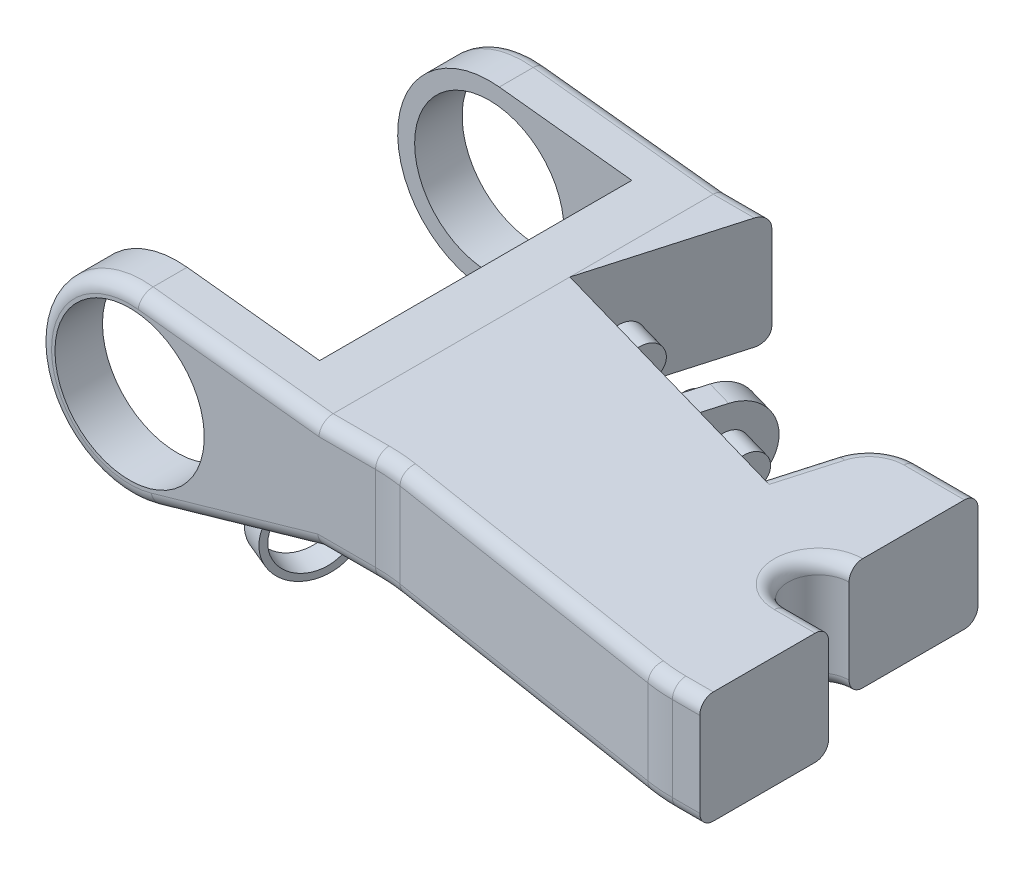
from build123d import *

# Parameters (mm, degrees)
EXTRUDE_1_DEPTH          = 13.5
CUT_EXTRUDE_1_DEPTH      = 134.515916654
CUT_EXTRUDE_1_DEPTH_BACK = 134.515916654
SKETCH_11_R              = 11
SKETCH_12_R              = 2.5
EXTRUDE_2_DEPTH          = 4.5
SKETCH_13_R              = 2.5
EXTRUDE_3_DEPTH          = 4.5
FILLET_1_R               = 25
EXTRUDE_START            = 4.5
SKETCH_21_R              = 2.5
EXTRUDE_5_DEPTH          = 4.5
SKETCH_22_R              = 2.5
EXTRUDE_6_DEPTH          = 4.5
CUT_EXTRUDE_5_DEPTH      = 4
FILLET_6_R               = 2
SKETCH_25_R              = 6
SKETCH_25_R_2            = 5
EXTRUDE_7_DEPTH          = 4


with BuildPart() as part:
    # Эскиз10 → Бобышка-Вытянуть1 (new, symmetric)
    with BuildSketch(Plane(origin=(0, 0, 0), x_dir=(1, 0, 0), z_dir=(0, 1, 0))):
        with BuildLine():
            Line((-20.48528137, 18.5), (-20.48528137, 37.5))
            Line((-20.48528137, 37.5), (-29.380741372, 37.5))
            ThreePointArc((-29.380741372, 37.5), (-33.710759363, 36.051196247), (-36.296953626, 32.288260244))
            Line((-36.296953626, 32.288260244), (-38.777689828, 23.636904981))
            Line((-38.777689828, 23.636904981), (-56.466321522, 28.7090385))
            Line((-56.466321522, 28.7090385), (-53.020854575, 40.724809699))
            Line((-53.020854575, 40.724809699), (-56.865901358, 41.827359122))
            Line((-56.865901358, 41.827359122), (-60.311368306, 29.811587923))
            Line((-60.311368306, 29.811587923), (-78, 34.883721442))
            Line((-78, 34.883721442), (-75.519263798, 43.535076705))
            Line((-75.519263798, 43.535076705), (-71.371513787, 58))
            Line((-71.371513787, 58), (-119.5, 58))
            Line((-119.5, 58), (-119.5, 54.5))
            Line((-119.5, 54.5), (-119.5, 51))
            Line((-119.5, 51), (-85, 51))
            Line((-85, 51), (-85, 13.5))
            Line((-85, 13.5), (-85, 5))
            Line((-85, 5), (-119.5, 5))
            Line((-119.5, 5), (-119.5, -2))
            Line((-119.5, -2), (-67.787212734, -2))
            Line((-67.787212734, -2), (-20.48528137, -9.5))
            Line((-20.48528137, -9.5), (-14.48528137, -9.5))
            Line((-14.48528137, -9.5), (-14.48528137, 9.5))
            Line((-14.48528137, 9.5), (-20.48528137, 9.5))
            ThreePointArc((-20.48528137, 9.5), (-24.98528137, 14), (-20.48528137, 18.5))
        make_face()
    extrude(amount=EXTRUDE_1_DEPTH, both=True)

    # Эскиз11 → Вырез-Вытянуть1 (cut, two sides: drawn at the far end of the back side and taken through both)
    with BuildSketch(Plane.XY.offset(-CUT_EXTRUDE_1_DEPTH_BACK)):
        with BuildLine():
            Line((-11.66726189, -13.5), (-11.66726189, -6))
            Line((-11.66726189, -6), (-78, -6))
            Line((-78, -6), (-102.271403318, -12.974882149))
            ThreePointArc((-102.271403318, -12.974882149), (-104.117303664, -13.368075946), (-106, -13.5))
            Line((-106, -13.5), (-11.66726189, -13.5))
        make_face()
        with BuildLine():
            Line((-78, 10.5), (-11.66726189, 10.5))
            Line((-11.66726189, 10.5), (-11.66726189, 13.5))
            Line((-11.66726189, 13.5), (-106, 13.5))
            ThreePointArc((-106, 13.5), (-105.260484121, 13.479729829), (-104.523188999, 13.418980187))
            Line((-104.523188999, 13.418980187), (-78, 10.5))
        make_face()
        with BuildLine():
            Line((-119.5, -13.5), (-106, -13.5))
            ThreePointArc((-106, -13.5), (-115.545941546, -9.545941546), (-119.5, 0))
            Line((-119.5, 0), (-119.5, -13.5))
        make_face()
        with BuildLine():
            ThreePointArc((-119.5, 0), (-115.545941546, 9.545941546), (-106, 13.5))
            Line((-106, 13.5), (-119.5, 13.5))
            Line((-119.5, 13.5), (-119.5, 0))
        make_face()
        with Locations(Location((-106, 0, 0), (0, 0, 180))):
            Circle(SKETCH_11_R)
    extrude(amount=CUT_EXTRUDE_1_DEPTH + CUT_EXTRUDE_1_DEPTH_BACK, mode=Mode.SUBTRACT)

    # Эскиз12 → Бобышка-Вытянуть2 (add)
    with BuildSketch(Plane(origin=(-63.628022056, 0, -18.24504173), x_dir=(-0.2756373558168795, 0, 0.9612616959383532), z_dir=(-0.9612616959383532, 0, -0.2756373558168795))):
        with Locations(Location((-18.53267148, 0, 0), (0, 0, 180))):
            Circle(SKETCH_12_R)
    extrude(amount=EXTRUDE_2_DEPTH)

    # Эскиз13 → Бобышка-Вытянуть3 (add)
    with BuildSketch(Plane(origin=(-42.094343578, 0, -12.070358788), x_dir=(-0.2756373558167246, 0, 0.9612616959383977), z_dir=(-0.9612616959383977, 0, -0.2756373558167246))):
        with Locations(Location((-18.53267148, 0, 0), (0, 0, 180))):
            Circle(SKETCH_13_R)
    extrude(amount=EXTRUDE_3_DEPTH)

    # Скругление1
    fillet_1_edges = [part.edges().sort_by_distance(p)[0] for p in [
        (-20.48528137, 2.25, 9.5),
        (-67.787212734, 2.25, 2),
    ]]
    fillet(fillet_1_edges, radius=FILLET_1_R)

    # Эскиз21 → Бобышка-Вытянуть5 (add)
    with BuildSketch(Plane(origin=(-81.31665375, 0, -23.317175248), x_dir=(0.2756373558168807, 0, -0.9612616959383529), z_dir=(0.9612616959383529, 0, 0.2756373558168807)).offset(EXTRUDE_START)):
        with Locations((18.53267148, 0)):
            Circle(SKETCH_21_R)
    extrude(amount=-EXTRUDE_5_DEPTH)

    # Эскиз22 → Бобышка-Вытянуть6 (add)
    with BuildSketch(Plane(origin=(-59.782975272, 0, -17.142492306), x_dir=(0.27563735581687987, 0, -0.9612616959383531), z_dir=(0.9612616959383531, 0, 0.27563735581687987)).offset(EXTRUDE_START)):
        with Locations((18.53267148, 0)):
            Circle(SKETCH_22_R)
    extrude(amount=-EXTRUDE_6_DEPTH)

    # Эскиз24 → Вырез-Вытянуть5 (cut)
    with BuildSketch(Plane(origin=(-59.782975272, 0, -17.142492306), x_dir=(0.27563735581687987, 0, -0.9612616959383531), z_dir=(0.9612616959383531, 0, 0.27563735581687987))):
        with BuildLine():
            Line((12.03267148, 6), (18.53267148, 6))
            ThreePointArc((18.53267148, 6), (22.775312167, 4.242640687), (24.53267148, 0))
            Line((24.53267148, 0), (24.53267148, 10.5))
            Line((24.53267148, 10.5), (12.03267148, 10.5))
            Line((12.03267148, 10.5), (12.03267148, 6))
        make_face()
        with BuildLine():
            ThreePointArc((24.53267148, 0), (22.775312167, -4.242640687), (18.53267148, -6))
            Line((18.53267148, -6), (24.53267148, -6))
            Line((24.53267148, -6), (24.53267148, 0))
        make_face()
    extrude(amount=-CUT_EXTRUDE_5_DEPTH, mode=Mode.SUBTRACT)

    # Скругление6
    fillet_6_edges = [part.edges().sort_by_distance(p)[0] for p in [
        (-24.933011371, 10.5, -37.5),
        (-24.933011371, -6, -37.5),
        (-90.135701659, -9.487441074, 2),
        (-90.135701659, -9.487441074, -58),
        (-24.98528137, -6, -14),
        (-33.710759363, -6, -36.051196247),
        (-37.537321727, -6, -27.962582613),
        (-17.48528137, -6, -9.5),
        (-74.685756894, -6, -58),
        (-91.261594499, 11.959490094, 2),
        (-37.537321727, 10.5, -27.962582613),
        (-33.710759363, 10.5, -36.051196247),
        (-24.98528137, 10.5, -14),
        (-16.50045822, 10.5, 9.5),
        (-17.48528137, 10.5, -9.5),
        (-73.878429516, 10.5, 2),
        (-74.685756894, 10.5, -58),
        (-91.261594499, 11.959490094, -58),
        (-16.50045822, -6, 9.5),
        (-73.878429516, -6, 2),
        (-44.136247052, -6, 5.75),
        (-20.479196677, -6, 9.422769225),
        (-44.136247052, 10.5, 5.75),
        (-20.479196677, 10.5, 9.422769225),
        (-67.793297427, -6, 2.077230775),
        (-67.793297427, 10.5, 2.077230775),
        (-119.368075946, -1.882696336, 2),
        (-119.368075946, -1.882696336, -58),
    ]]
    fillet(fillet_6_edges, radius=FILLET_6_R)

    # Эскиз25 → Бобышка-Вытянуть7 (add)
    with BuildSketch(Plane(origin=(-79.849510394, 0, -33.074750154), x_dir=(-0.38268343236509106, 0, 0.9238795325112863), z_dir=(-0.9238795325112862, 0, -0.382683432365091))):
        with Locations((27.935890563, -12)):
            Circle(SKETCH_25_R)
        with Locations((27.935890563, -12)):
            Circle(SKETCH_25_R_2, mode=Mode.SUBTRACT)
    extrude(amount=-EXTRUDE_7_DEPTH)


solid = part.part
